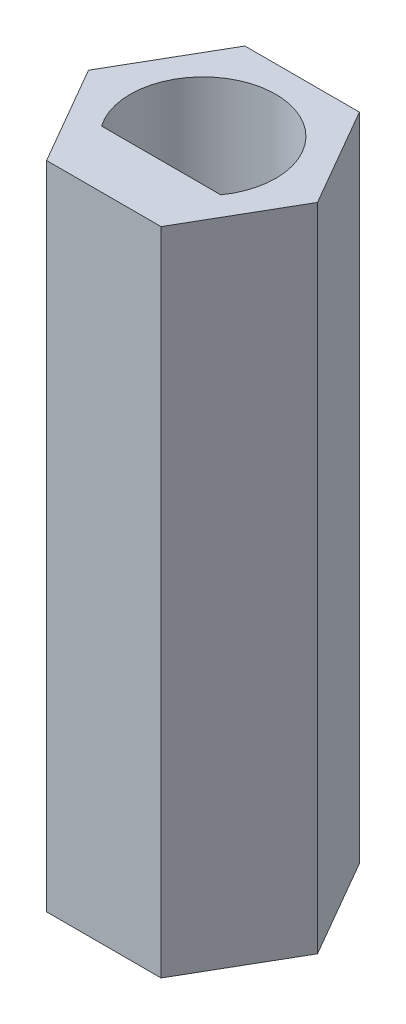
from build123d import *

# Parameters (mm, degrees)
SALIENTE_EXTRUIR1_DEPTH = 28
CORTAR_EXTRUIR1_DEPTH   = 8.3
CROQUIS3_R              = 1.5
CORTAR_EXTRUIR2_DEPTH   = 18
CROQUIS4_R              = 4
CORTAR_EXTRUIR3_DEPTH   = 7


with BuildPart() as part:
    # Croquis1 → Saliente-Extruir1 (new body)
    with BuildSketch(Plane(origin=(0, 0, 0), x_dir=(1, 0, 0), z_dir=(0, 1, 0))):
        Polygon((3.695041723, 0), (1.847520861, 3.2), (-1.847520861, 3.2), (-3.695041723, 0), (-1.847520861, -3.2), (1.847520861, -3.2), align=None)
    extrude(amount=SALIENTE_EXTRUIR1_DEPTH)

    # Croquis2 → Cortar-Extruir1 (cut)
    with BuildSketch(Plane(origin=(0, 28, 0), x_dir=(1, 0, 0), z_dir=(0, 1, 0))):
        with BuildLine():
            Line((-1.923538406, -1.35), (1.923538406, -1.35))
            ThreePointArc((1.923538406, -1.35), (0, 2.35), (-1.923538406, -1.35))
        make_face()
    extrude(amount=-CORTAR_EXTRUIR1_DEPTH, mode=Mode.SUBTRACT)

    # Croquis3 → Cortar-Extruir2 (cut)
    with BuildSketch(Plane(origin=(0, 0, 0), x_dir=(-1, 0, 0), z_dir=(0, -1, 0))):
        with Locations(Location((0, 0, 0), (0, 0, 90))):
            Circle(CROQUIS3_R)
    extrude(amount=-CORTAR_EXTRUIR2_DEPTH, mode=Mode.SUBTRACT)

    # Croquis4 → Cortar-Extruir3 (cut)
    with BuildSketch(Plane.XZ):
        Circle(CROQUIS4_R)
    extrude(amount=-CORTAR_EXTRUIR3_DEPTH, mode=Mode.SUBTRACT)


solid = part.part
